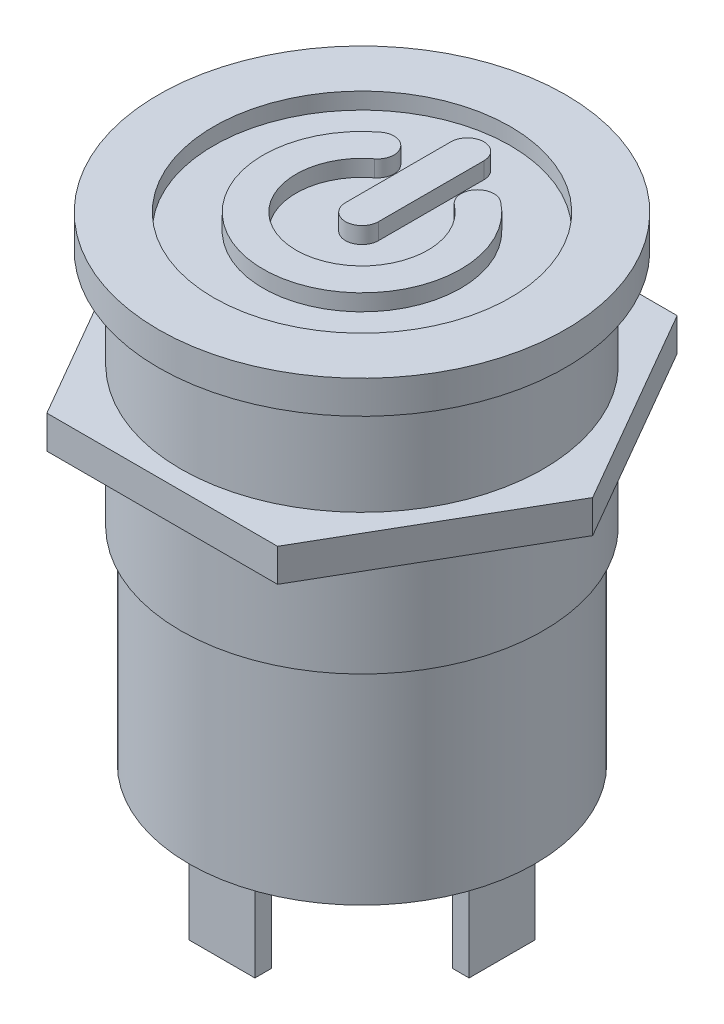
from build123d import *

# Parameters (mm, degrees)
ESQUISSE1_R             = 11
BOSS_EXTRU_1_DEPTH      = 14.5
ESQUISSE2_R             = 12.35
BOSS_EXTRU_2_DEPTH      = 2
ESQUISSE3_R             = 9
ENL_V_MAT_EXTRU_1_DEPTH = 1
ESQUISSE4_R             = 10.5
BOSS_EXTRU_3_DEPTH      = 12.5
ESQUISSE5_W             = 1
ESQUISSE5_H             = 4
ESQUISSE5_W_2           = 4
ESQUISSE5_H_2           = 1
BOSS_EXTRU_4_DEPTH      = 6
BOSS_EXTRU_5_START      = 6
BOSS_EXTRU_5_DEPTH      = 2


with BuildPart() as part:
    # Esquisse1 → Boss.-Extru.1 (new body)
    with BuildSketch(Plane(origin=(0, 0, 0), x_dir=(1, 0, 0), z_dir=(0, 1, 0))):
        with Locations(Location((0, 0, 0), (0, 0, 270))):
            Circle(ESQUISSE1_R)
    extrude(amount=-BOSS_EXTRU_1_DEPTH)

    # Esquisse2 → Boss.-Extru.2 (add)
    with BuildSketch(Plane(origin=(0, 0, 0), x_dir=(1, 0, 0), z_dir=(0, 1, 0))):
        with Locations(Location((0, 0, 0), (0, 0, 270))):
            Circle(ESQUISSE2_R)
    extrude(amount=BOSS_EXTRU_2_DEPTH)

    # Esquisse3 → Enlèv. mat.-Extru.1 (cut)
    with BuildSketch(Plane(origin=(0, 2, 0), x_dir=(1, 0, 0), z_dir=(0, 1, 0))):
        with Locations(Location((0, 0, 0), (0, 0, 270))):
            Circle(ESQUISSE3_R)
        with BuildLine():
            Line((-1, 0), (-1, 6.394930003))
            ThreePointArc((-1, 6.394930003), (0, 7.394930003), (1, 6.394930003))
            Line((1, 6.394930003), (1, 0))
            ThreePointArc((1, 0), (0, -1), (-1, 0))
        make_face(mode=Mode.SUBTRACT)
        with BuildLine():
            ThreePointArc((-3.641353304, 4.768704868), (0, -6), (3.641353304, 4.768704868))
            ThreePointArc((3.641353304, 4.768704868), (2.239676942, 4.58081294), (2.427568869, 3.179136578))
            ThreePointArc((2.427568869, 3.179136578), (0, -4), (-2.427568869, 3.179136578))
            ThreePointArc((-2.427568869, 3.179136578), (-2.239676942, 4.58081294), (-3.641353304, 4.768704868))
        make_face(mode=Mode.SUBTRACT)
    extrude(amount=-ENL_V_MAT_EXTRU_1_DEPTH, mode=Mode.SUBTRACT)

    # Esquisse4 → Boss.-Extru.3 (add)
    with BuildSketch(Plane.XZ.offset(14.5)):
        with Locations(Location((0, 0, 0), (0, 0, 270))):
            Circle(ESQUISSE4_R)
    extrude(amount=BOSS_EXTRU_3_DEPTH)

    # Esquisse5 → Boss.-Extru.4 (add)
    with BuildSketch(Plane.XZ.offset(27)):
        with Locations((-8, 0)):
            Rectangle(ESQUISSE5_W, ESQUISSE5_H)
        with Locations((0, 8)):
            Rectangle(ESQUISSE5_W_2, ESQUISSE5_H_2)
        with Locations((0, -8)):
            Rectangle(ESQUISSE5_W_2, ESQUISSE5_H_2)
        with Locations((8, 0)):
            Rectangle(ESQUISSE5_W, ESQUISSE5_H)
    extrude(amount=BOSS_EXTRU_4_DEPTH)

    # Esquisse6 → Boss.-Extru.5 (add)
    with BuildSketch(Plane.XZ.offset(BOSS_EXTRU_5_START)):
        Polygon((14, 0), (7, 12.124355653), (-7, 12.124355653), (-14, 0), (-7, -12.124355653), (7, -12.124355653), align=None)
    extrude(amount=BOSS_EXTRU_5_DEPTH)


solid = part.part
